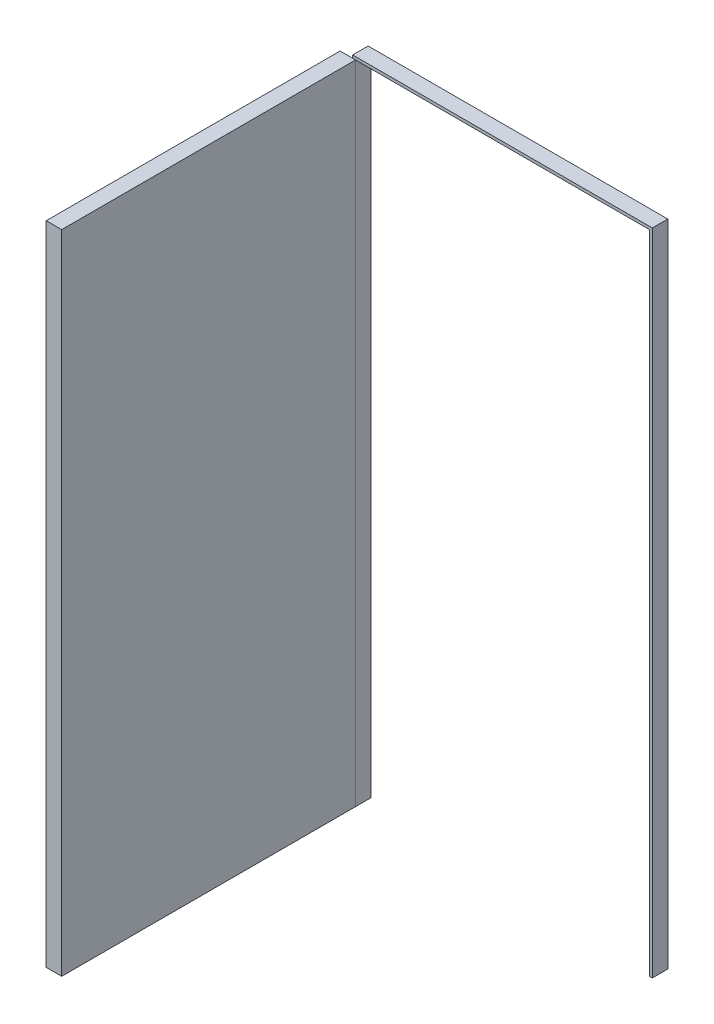
from build123d import *

# Parameters (mm, degrees)
BOSS_EXTRUDE1_DEPTH = 101.6
SKETCH2_W           = 101.6
SKETCH2_H           = 1930.4
BOSS_EXTRUDE2_DEPTH = 4248.15
BOSS_EXTRUDE3_START = -228.6
BOSS_EXTRUDE3_DEPTH = 38.1
FILLET1_R           = 38.1
FILLET2_R           = 12.7
FILLET3_R           = 12.7


with BuildPart() as part:
    # Sketch1 → Boss-Extrude1 (new body)
    with BuildSketch(Plane.XY):
        Polygon((965.2, 2114.55), (965.2, -2133.6), (984.25, -2133.6), (984.25, 2133.6), (-984.25, 2133.6), (-984.25, -2133.6), (-965.2, -2133.6), (-965.2, 2114.55), align=None)
    extrude(amount=BOSS_EXTRUDE1_DEPTH)


with BuildPart() as body_2:
    # Sketch2 → Boss-Extrude2 (new body)
    with BuildSketch(Plane.XZ.offset(2133.6)):
        with Locations((-1016, 1066.8)):
            Rectangle(SKETCH2_W, SKETCH2_H)
    extrude(amount=-BOSS_EXTRUDE2_DEPTH)

    # Sketch3 → Boss-Extrude3 (add)
    with BuildSketch(Plane.XY.offset(2032).offset(BOSS_EXTRUDE3_START)):
        Polygon((-1066.8, -787.4), (-1193.8, -787.4), (-1193.8, -1117.6), (-1066.8, -1117.6), (-1066.8, -1066.8), (-1143, -1066.8), (-1143, -838.2), (-1066.8, -838.2), align=None)
    extrude(amount=BOSS_EXTRUDE3_DEPTH)

    # Fillet1
    fillet1_edges = [body_2.edges().sort_by_distance(p)[0] for p in [
        (-1193.8, -787.4, 1822.45),
        (-1193.8, -1117.6, 1822.45),
    ]]
    fillet(fillet1_edges, radius=FILLET1_R)

    # Fillet2
    fillet2_edges = [body_2.edges().sort_by_distance(p)[0] for p in [
        (-1143, -1066.8, 1822.45),
        (-1143, -838.2, 1822.45),
    ]]
    fillet(fillet2_edges, radius=FILLET2_R)

    # Fillet3
    fillet3_edges = [body_2.edges().sort_by_distance(p)[0] for p in [
        (-1111.25, -787.4, 1803.4),
        (-1098.55, -1066.8, 1803.4),
        (-1111.25, -787.4, 1841.5),
        (-1098.55, -1066.8, 1841.5),
        (-1111.25, -1117.6, 1803.4),
        (-1111.25, -1117.6, 1841.5),
        (-1193.8, -952.5, 1803.4),
        (-1182.640768363, -798.559231637, 1803.4),
        (-1182.640768363, -1106.440768363, 1803.4),
        (-1193.8, -952.5, 1841.5),
        (-1182.640768363, -798.559231637, 1841.5),
        (-1182.640768363, -1106.440768363, 1841.5),
        (-1143, -952.5, 1803.4),
        (-1143, -952.5, 1841.5),
        (-1098.55, -838.2, 1803.4),
        (-1098.55, -838.2, 1841.5),
        (-1139.280256121, -1063.080256121, 1803.4),
        (-1139.280256121, -1063.080256121, 1841.5),
        (-1139.280256121, -841.919743879, 1803.4),
        (-1139.280256121, -841.919743879, 1841.5),
    ]]
    fillet(fillet3_edges, radius=FILLET3_R)


solid = Compound([part.part, body_2.part])
